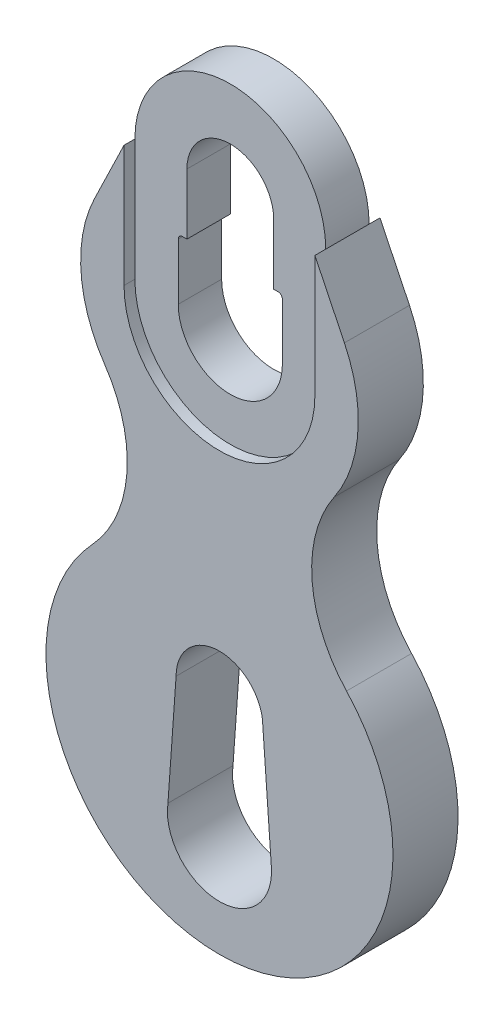
from build123d import *

# Parameters (mm, degrees)
BOSS_EXTRUDE3_DEPTH = 5
BOSS_EXTRUDE4_DEPTH = 7.5


with BuildPart() as part:
    # Sketch1 → Boss-Extrude3 (new, symmetric)
    with BuildSketch(Plane.XY):
        with BuildLine():
            Line((22, 82.563407366), (22, 110.563407366))
            ThreePointArc((22, 110.563407366), (0, 132.563407366), (-22, 110.563407366))
            Line((-22, 110.563407366), (-22, 82.563407366))
            ThreePointArc((-22, 82.563407366), (0, 60.563407366), (22, 82.563407366))
        make_face()
        with BuildLine():
            ThreePointArc((-10, 110.563407366), (0, 120.563407366), (10, 110.563407366))
            Line((10, 110.563407366), (10, 96.563407366))
            Line((10, 96.563407366), (11, 96.563407366))
            ThreePointArc((11, 96.563407366), (11.707106781, 96.270514148), (12, 95.563407366))
            Line((12, 95.563407366), (12, 82.563407366))
            ThreePointArc((12, 82.563407366), (0, 70.563407366), (-12, 82.563407366))
            Line((-12, 82.563407366), (-12, 95.563407366))
            ThreePointArc((-12, 95.563407366), (-11.707106781, 96.270514148), (-11, 96.563407366))
            Line((-11, 96.563407366), (-10, 96.563407366))
            Line((-10, 96.563407366), (-10, 110.563407366))
        make_face(mode=Mode.SUBTRACT)
    extrude(amount=BOSS_EXTRUDE3_DEPTH, both=True)

    # Sketch1<5> → Boss-Extrude4 (add, symmetric)
    with BuildSketch(Plane.XY):
        with BuildLine():
            Line((28.804390709, 96.502814665), (22, 110.563407366))
            Line((22, 110.563407366), (22, 82.563407366))
            ThreePointArc((22, 82.563407366), (0, 60.563407366), (-22, 82.563407366))
            Line((-22, 82.563407366), (-22, 110.563407366))
            Line((-22, 110.563407366), (-28.804390709, 96.502814665))
            ThreePointArc((-28.804390709, 96.502814665), (-31.91369551, 80.214782471), (-26.453432284, 64.557410577))
            ThreePointArc((-26.453432284, 64.557410577), (-21.339698738, 45.404566029), (-29.2877286, 27.243879192))
            ThreePointArc((-29.2877286, 27.243879192), (0, -40), (29.2877286, 27.243879192))
            ThreePointArc((29.2877286, 27.243879192), (21.339698738, 45.404566029), (26.453432284, 64.557410577))
            ThreePointArc((26.453432284, 64.557410577), (31.91369551, 80.214782471), (28.804390709, 96.502814665))
        make_face()
        with BuildLine():
            Line((-11.878172589, -15.731008877), (-10, 10.563407366))
            ThreePointArc((-10, 10.563407366), (0, 20.563407366), (10, 10.563407366))
            Line((10, 10.563407366), (11.968538667, -16.568213586))
            ThreePointArc((11.968538667, -16.568213586), (0.434474391, -29.428724721), (-12, -17.436592634))
            ThreePointArc((-12, -17.436592634), (-11.969504398, -16.581628034), (-11.878172589, -15.731008877))
        make_face(mode=Mode.SUBTRACT)
    extrude(amount=BOSS_EXTRUDE4_DEPTH, both=True)


solid = part.part
